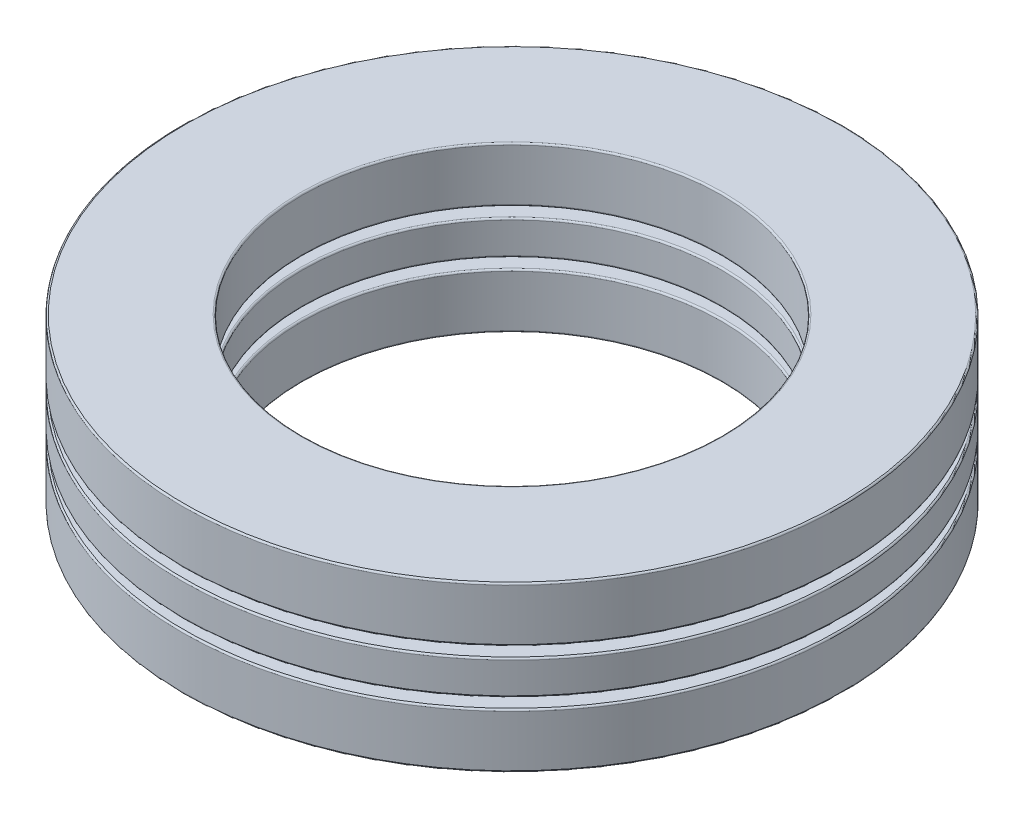
from build123d import *

# Parameters (mm, degrees)
SKETCH1_W         = 6.35
SKETCH1_H         = 1.80975
CIRPATTERN1_COUNT = 7
CIRPATTERN1_ANGLE = 308.571428571
CIRPATTERN2_COUNT = 7
SKETCH4_W         = 6.35
SKETCH4_H         = 2.8956
FILLET1_R         = 0.086868
FILLET2_R         = 0.086868
FILLET3_R         = 0.086868


with BuildPart() as part:
    # Sketch1 → Revolve1 (revolve)
    with BuildSketch(Plane(origin=(0, 0, 0), x_dir=(0, 0, -1), z_dir=(1, 0, 0)), mode=Mode.PRIVATE) as revolve1_sk:
        with Locations((-14.2875, 0)):
            Rectangle(SKETCH1_W, SKETCH1_H)
    revolve(revolve1_sk.sketch.rotate(Axis((0, -4.3434, 0), (0, 1, 0)), 180), axis=Axis((0, -4.3434, 0), (0, 1, 0)))

    # Sketch3 → Cut-Revolve1 (revolve, cut)
    with BuildSketch(Plane(origin=(0, 0, 0), x_dir=(0, 0, -1), z_dir=(1, 0, 0))):
        with BuildLine():
            Line((-14.2875, 1.4478), (-14.2875, -1.4478))
            ThreePointArc((-14.2875, -1.4478), (-15.7353, 0), (-14.2875, 1.4478))
        make_face()
    cut_revolve1 = revolve(axis=Axis((0, 1.4478, 14.2875), (0, -1, 0)), mode=Mode.SUBTRACT)

    # CirPattern2: Cut-Revolve1 ×7 about axis
    cirpattern2_axis = Axis((0, 0, 0), (0, 1, 0))
    for i in range(1, CIRPATTERN2_COUNT):
        add(cut_revolve1.rotate(cirpattern2_axis, i * 360 / CIRPATTERN2_COUNT), mode=Mode.SUBTRACT)

    # Fillet2
    fillet2_edges = [part.edges().sort_by_distance(p)[0] for p in [
        (0, 0.904875, 17.4625),
        (0, 0.904875, 11.1125),
        (0, -0.904875, 11.1125),
        (0, -0.904875, 17.4625),
    ]]
    fillet(fillet2_edges, radius=FILLET2_R)


with BuildPart() as body_2:
    # Sketch2 → Revolve2 (revolve)
    with BuildSketch(Plane(origin=(0, 0, 0), x_dir=(0, 0, -1), z_dir=(1, 0, 0))):
        with BuildLine():
            Line((-14.2875, 1.4478), (-14.2875, -1.4478))
            ThreePointArc((-14.2875, -1.4478), (-15.7353, 0), (-14.2875, 1.4478))
        make_face()
    revolve(axis=Axis((0, 1.4478, 14.2875), (0, -1, 0)))


with BuildPart() as cirpattern1_1:
    # CirPattern1: pattern copy
    add(body_2.part.rotate(Axis((0, 4.3434, 0), (0, -1, 0)), 1 * CIRPATTERN1_ANGLE / (CIRPATTERN1_COUNT - 1)))


with BuildPart() as cirpattern1_2:
    # CirPattern1: pattern copy
    add(body_2.part.rotate(Axis((0, 4.3434, 0), (0, -1, 0)), 2 * CIRPATTERN1_ANGLE / (CIRPATTERN1_COUNT - 1)))


with BuildPart() as cirpattern1_3:
    # CirPattern1: pattern copy
    add(body_2.part.rotate(Axis((0, 4.3434, 0), (0, -1, 0)), 3 * CIRPATTERN1_ANGLE / (CIRPATTERN1_COUNT - 1)))


with BuildPart() as cirpattern1_4:
    # CirPattern1: pattern copy
    add(body_2.part.rotate(Axis((0, 4.3434, 0), (0, -1, 0)), 4 * CIRPATTERN1_ANGLE / (CIRPATTERN1_COUNT - 1)))


with BuildPart() as cirpattern1_5:
    # CirPattern1: pattern copy
    add(body_2.part.rotate(Axis((0, 4.3434, 0), (0, -1, 0)), 5 * CIRPATTERN1_ANGLE / (CIRPATTERN1_COUNT - 1)))


with BuildPart() as cirpattern1_6:
    # CirPattern1: pattern copy
    add(body_2.part.rotate(Axis((0, 4.3434, 0), (0, -1, 0)), 6 * CIRPATTERN1_ANGLE / (CIRPATTERN1_COUNT - 1)))


with BuildPart() as body_9:
    # Sketch4 → Revolve3 (revolve)
    with BuildSketch(Plane(origin=(0, 0, 0), x_dir=(0, 0, -1), z_dir=(1, 0, 0)), mode=Mode.PRIVATE) as revolve3_sk:
        with Locations((-14.2875, 2.8956)):
            Rectangle(SKETCH4_W, SKETCH4_H)
        with Locations((-14.2875, -2.8956)):
            Rectangle(SKETCH4_W, SKETCH4_H)
    revolve(revolve3_sk.sketch.rotate(Axis((0, -4.3434, 0), (0, 1, 0)), 180), axis=Axis((0, -4.3434, 0), (0, 1, 0)))

    # Fillet1
    fillet1_edges = [body_9.edges().sort_by_distance(p)[0] for p in [
        (0, 1.4478, 17.4625),
        (0, 1.4478, 11.1125),
        (0, 4.3434, 11.1125),
        (0, 4.3434, 17.4625),
    ]]
    fillet(fillet1_edges, radius=FILLET1_R)

    # Fillet3
    fillet3_edges = [body_9.edges().sort_by_distance(p)[0] for p in [
        (0, -4.3434, 17.4625),
        (0, -4.3434, 11.1125),
        (0, -1.4478, 11.1125),
        (0, -1.4478, 17.4625),
    ]]
    fillet(fillet3_edges, radius=FILLET3_R)


solid = Compound([part.part, body_2.part, cirpattern1_1.part, cirpattern1_2.part, cirpattern1_3.part, cirpattern1_4.part, cirpattern1_5.part, cirpattern1_6.part, body_9.part])
